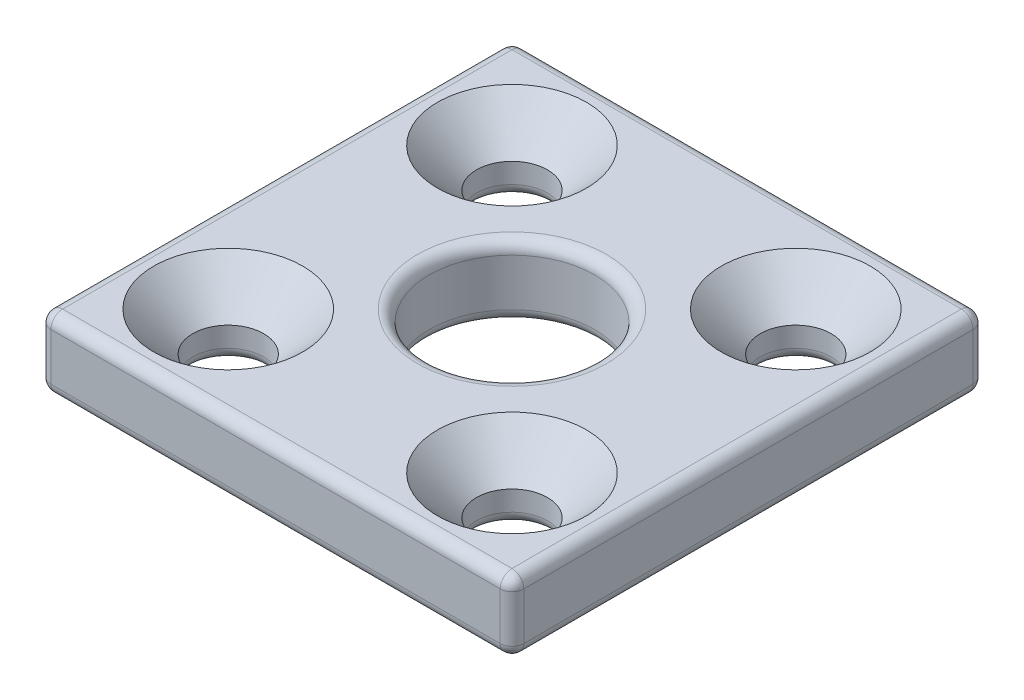
from build123d import *

# Parameters (mm, degrees)
SKETCH1_W           = 20
SKETCH1_H           = 20
SKETCH1_R           = 1.5
SKETCH1_R_2         = 3.5
BOSS_EXTRUDE1_DEPTH = 3
CHAMFER1_SIZE       = 1.65
FILLET1_R           = 0.5


with BuildPart() as part:
    # Sketch1 → Boss-Extrude1 (new body)
    with BuildSketch(Plane(origin=(0, 0, 0), x_dir=(1, 0, 0), z_dir=(0, 1, 0))):
        with Locations((10, 10)):
            Rectangle(SKETCH1_W, SKETCH1_H)
        with Locations(Location((16, 16, 0), (0, 0, 270))):
            Circle(SKETCH1_R, mode=Mode.SUBTRACT)
        with Locations(Location((4, 16, 0), (0, 0, 90))):
            Circle(SKETCH1_R, mode=Mode.SUBTRACT)
        with Locations(Location((16, 4, 0), (0, 0, 90))):
            Circle(SKETCH1_R, mode=Mode.SUBTRACT)
        with Locations(Location((4, 4, 0), (0, 0, 270))):
            Circle(SKETCH1_R, mode=Mode.SUBTRACT)
        with Locations(Location((10, 10, 0), (0, 0, 270))):
            Circle(SKETCH1_R_2, mode=Mode.SUBTRACT)
    extrude(amount=BOSS_EXTRUDE1_DEPTH)

    # Chamfer1
    chamfer1_edges = [part.edges().sort_by_distance(p)[0] for p in [
        (16, 3, -17.5),
        (4, 3, -14.5),
        (16, 3, -2.5),
        (4, 3, -5.5),
    ]]
    chamfer(chamfer1_edges, length=CHAMFER1_SIZE)

    # Fillet1
    fillet1_edges = [part.edges().sort_by_distance(p)[0] for p in [
        (16, 0, -17.5),
        (20, 3, -10),
        (4, 0, -14.5),
        (10, 3, -20),
        (16, 0, -2.5),
        (4, 0, -5.5),
        (10, 0, -13.5),
        (10, 3, -13.5),
        (0, 3, -10),
        (10, 0, -20),
        (20, 0, -10),
        (10, 0, 0),
        (0, 0, -10),
        (0, 1.5, -20),
        (20, 1.5, -20),
        (20, 1.5, 0),
        (0, 1.5, 0),
        (10, 3, 0),
    ]]
    fillet(fillet1_edges, radius=FILLET1_R)


solid = part.part
